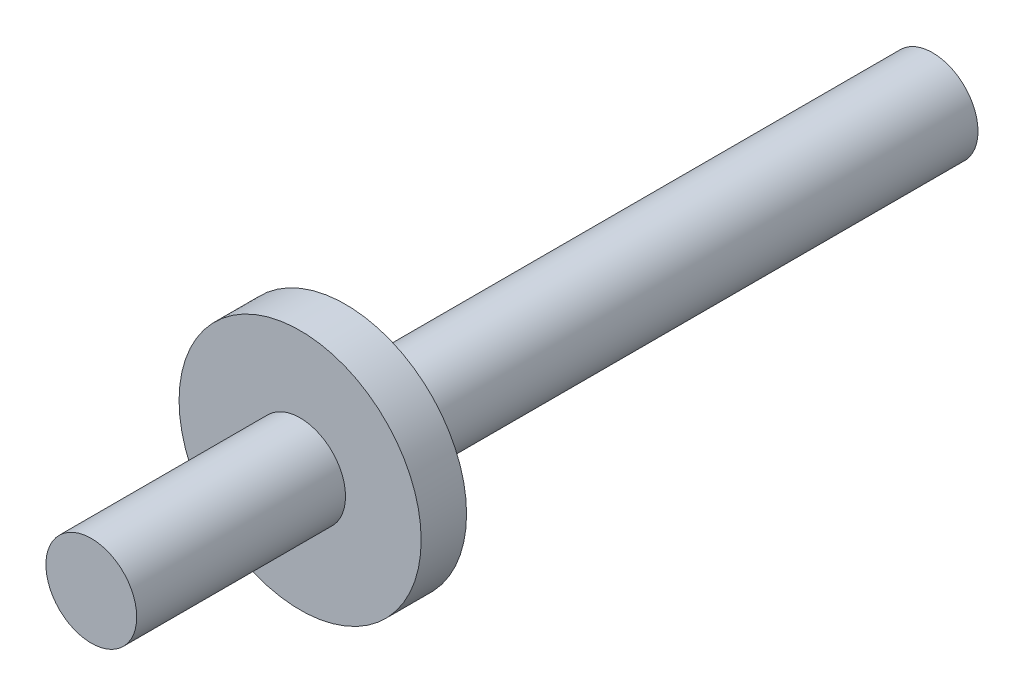
from build123d import *

# Parameters (mm, degrees)
SKETCH1_R                = 40
BOSS_EXTRUDE1_DEPTH      = 15
BOSS_EXTRUDE2_DEPTH      = 69
BOSS_EXTRUDE2_DEPTH_BACK = 209
SKETCH2_R                = 15


with BuildPart() as part:
    # Sketch1 → Boss-Extrude1 (new body)
    with BuildSketch(Plane.XY):
        with Locations((75, -1230.027041119)):
            Circle(SKETCH1_R)
    extrude(amount=BOSS_EXTRUDE1_DEPTH)

    # Sketch2 → Boss-Extrude2 (add, two sides: drawn at the far end of the back side and taken through both)
    with BuildSketch(Plane.XY.offset(15).offset(-BOSS_EXTRUDE2_DEPTH_BACK)):
        with Locations((75, -1230.027041119)):
            Circle(SKETCH2_R)
    extrude(amount=BOSS_EXTRUDE2_DEPTH + BOSS_EXTRUDE2_DEPTH_BACK)


solid = part.part
